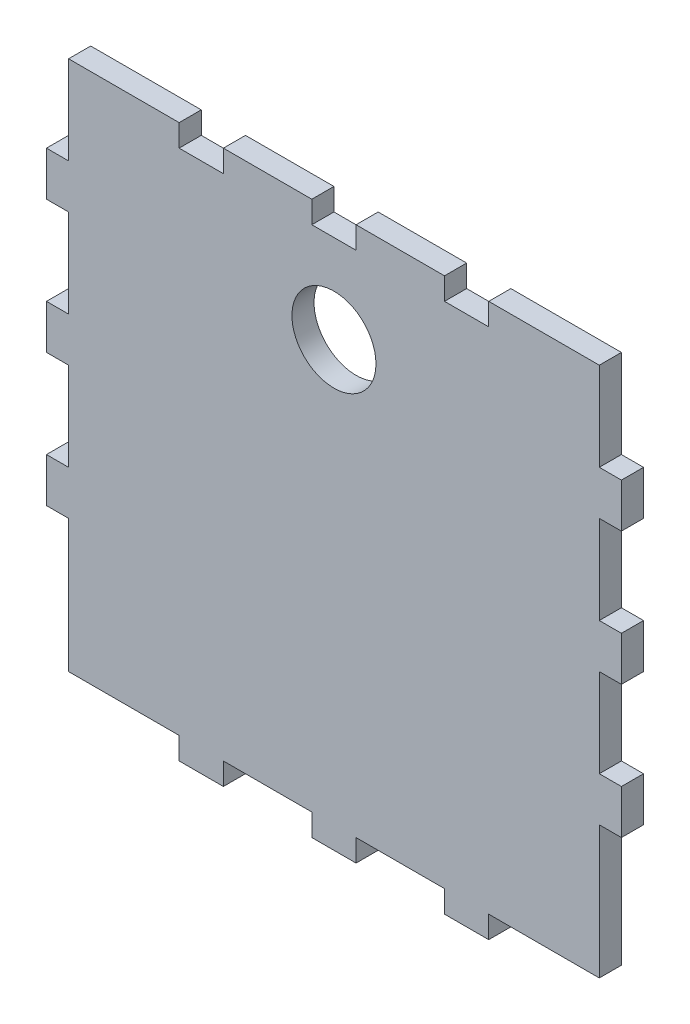
from build123d import *

# Parameters (mm, degrees)
SKETCH1_R           = 9.5
BOSS_EXTRUDE1_DEPTH = 5


with BuildPart() as part:
    # Sketch1 → Boss-Extrude1 (new body)
    with BuildSketch(Plane.XY):
        Polygon((-35, 60), (-35, 55), (-25, 55), (-25, 60), (-5, 60), (-5, 55), (5, 55), (5, 60), (25, 60), (25, 55), (35, 55), (35, 60), (60, 60), (60, 40), (65, 40), (65, 30), (60, 30), (60, 10), (65, 10), (65, 0), (60, 0), (60, -20), (65, -20), (65, -30), (60, -30), (60, -60), (35, -60), (35, -65), (25, -65), (25, -60), (5, -60), (5, -65), (-5, -65), (-5, -60), (-25, -60), (-25, -65), (-35, -65), (-35, -60), (-60, -60), (-60, -30), (-65, -30), (-65, -20), (-60, -20), (-60, 0), (-65, 0), (-65, 10), (-60, 10), (-60, 30), (-65, 30), (-65, 40), (-60, 40), (-60, 60), align=None)
        with Locations((0, 35)):
            Circle(SKETCH1_R, mode=Mode.SUBTRACT)
    extrude(amount=BOSS_EXTRUDE1_DEPTH)


solid = part.part
